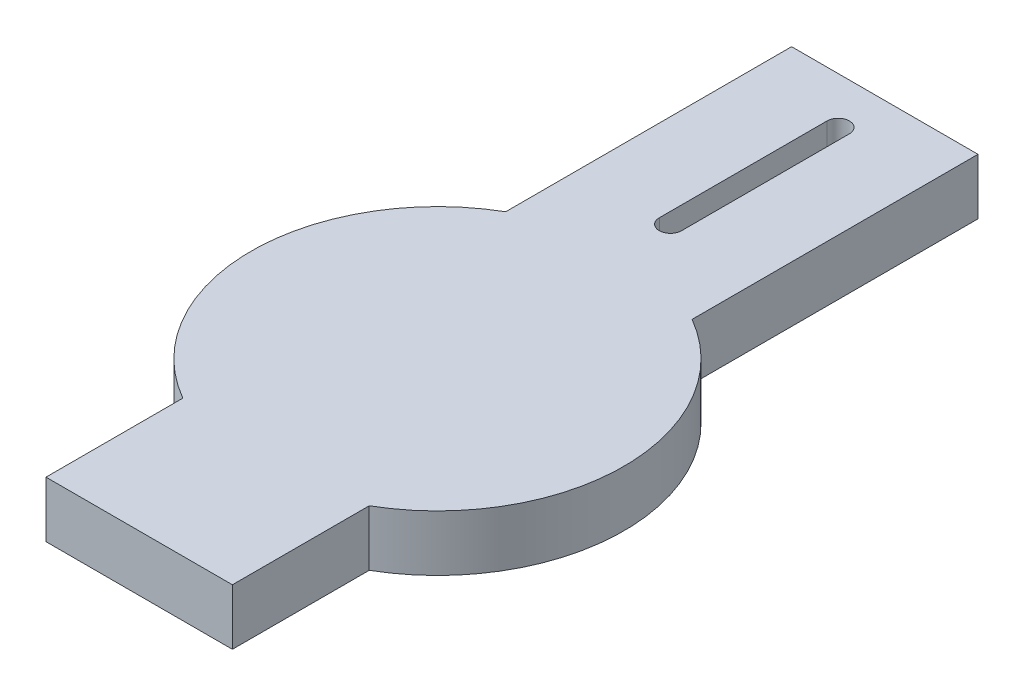
from build123d import *

# Parameters (mm, degrees)
BOSS_EXTRUDE1_DEPTH = 3.81


with BuildPart() as part:
    # Sketch2 → Boss-Extrude1 (new body)
    with BuildSketch(Plane(origin=(0, 0, 0), x_dir=(1, 0, 0), z_dir=(0, 1, 0))):
        with BuildLine():
            Line((6.35, 10.998522628), (6.35, 30.48))
            Line((6.35, 30.48), (-6.35, 30.48))
            Line((-6.35, 30.48), (-6.35, 10.998522628))
            ThreePointArc((-6.35, 10.998522628), (-12.7, 0), (-6.35, -10.998522628))
            Line((-6.35, -10.998522628), (-6.35, -20.32))
            Line((-6.35, -20.32), (6.35, -20.32))
            Line((6.35, -20.32), (6.35, -10.998522628))
            ThreePointArc((6.35, -10.998522628), (12.7, 0), (6.35, 10.998522628))
        make_face()
        with BuildLine():
            Line((-0.762, 15.875), (-0.762, 27.305))
            ThreePointArc((-0.762, 27.305), (0, 28.067), (0.762, 27.305))
            Line((0.762, 27.305), (0.762, 15.875))
            ThreePointArc((0.762, 15.875), (0, 15.113), (-0.762, 15.875))
        make_face(mode=Mode.SUBTRACT)
    extrude(amount=BOSS_EXTRUDE1_DEPTH)


solid = part.part
